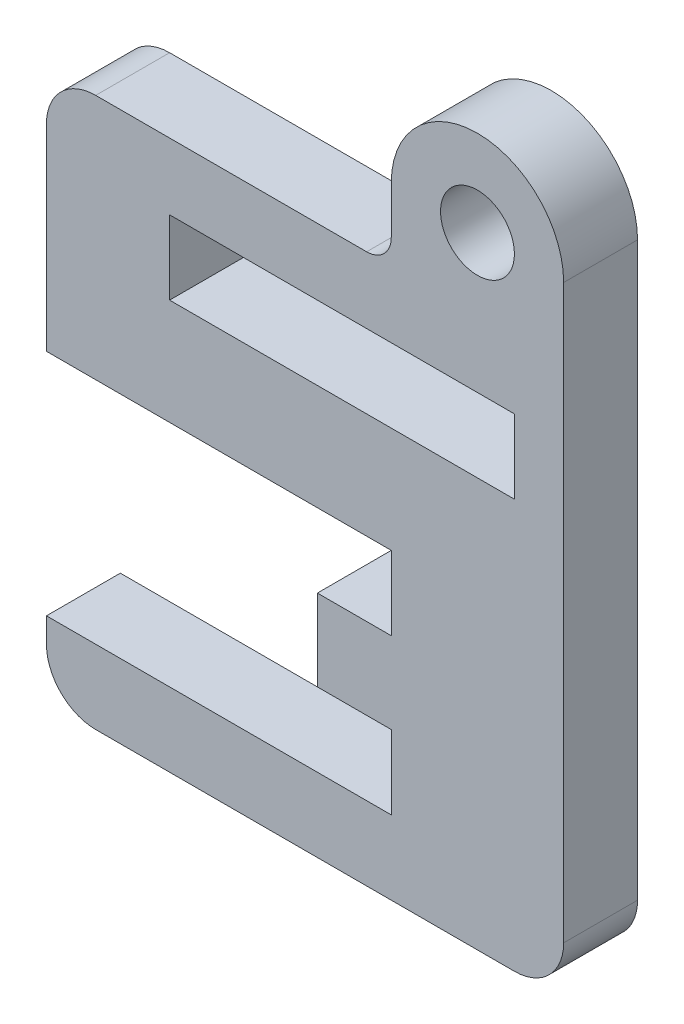
from build123d import *

# Parameters (mm, degrees)
BOSS_EXTRUDE1_DEPTH = 3
SKETCH4_W           = 14
SKETCH4_H           = 3
CUT_EXTRUDE1_DEPTH  = 3
SKETCH5_R           = 1.5
CUT_EXTRUDE2_DEPTH  = 3
SKETCH6_W           = 11
SKETCH6_H           = 3.3
CUT_EXTRUDE3_DEPTH  = 3


with BuildPart() as part:
    # Sketch2 → Boss-Extrude1 (new body)
    with BuildSketch(Plane.XY):
        with BuildLine():
            Line((-1.603783622, 21.086206065), (-1.603783622, -2.133793935))
            ThreePointArc((-1.603783622, -2.133793935), (-2.189570059, -3.548007497), (-3.603783622, -4.133793935))
            Line((-3.603783622, -4.133793935), (-20.603783622, -4.133793935))
            ThreePointArc((-20.603783622, -4.133793935), (-22.017997184, -3.548007497), (-22.603783622, -2.133793935))
            Line((-22.603783622, -2.133793935), (-22.603783622, 16.166206065))
            ThreePointArc((-22.603783622, 16.166206065), (-22.017997184, 17.580419628), (-20.603783622, 18.166206065))
            Line((-20.603783622, 18.166206065), (-9.603783622, 18.166206065))
            ThreePointArc((-9.603783622, 18.166206065), (-8.896676841, 18.459099284), (-8.603783622, 19.166206065))
            Line((-8.603783622, 19.166206065), (-8.603783622, 21.086206065))
            ThreePointArc((-8.603783622, 21.086206065), (-5.103783622, 24.586206065), (-1.603783622, 21.086206065))
        make_face()
    extrude(amount=BOSS_EXTRUDE1_DEPTH)

    # Sketch4 → Cut-Extrude1 (cut)
    with BuildSketch(Plane.XY.offset(3)):
        with Locations((-10.603783622, 13.966206065)):
            Rectangle(SKETCH4_W, SKETCH4_H)
        with Locations((-15.603783622, 6.666206065)):
            Rectangle(SKETCH4_W, SKETCH4_H)
        with Locations((-15.603783622, 0.366206065)):
            Rectangle(SKETCH4_W, SKETCH4_H)
    extrude(amount=-CUT_EXTRUDE1_DEPTH, mode=Mode.SUBTRACT)

    # Sketch5 → Cut-Extrude2 (cut)
    with BuildSketch(Plane.XY.offset(3)):
        with Locations((-5.103783622, 21.086206065)):
            Circle(SKETCH5_R)
    extrude(amount=-CUT_EXTRUDE2_DEPTH, mode=Mode.SUBTRACT)

    # Sketch6 → Cut-Extrude3 (cut)
    with BuildSketch(Plane.XY.offset(3)):
        with Locations((-17.103783622, 3.516206065)):
            Rectangle(SKETCH6_W, SKETCH6_H)
    extrude(amount=-CUT_EXTRUDE3_DEPTH, mode=Mode.SUBTRACT)


solid = part.part
